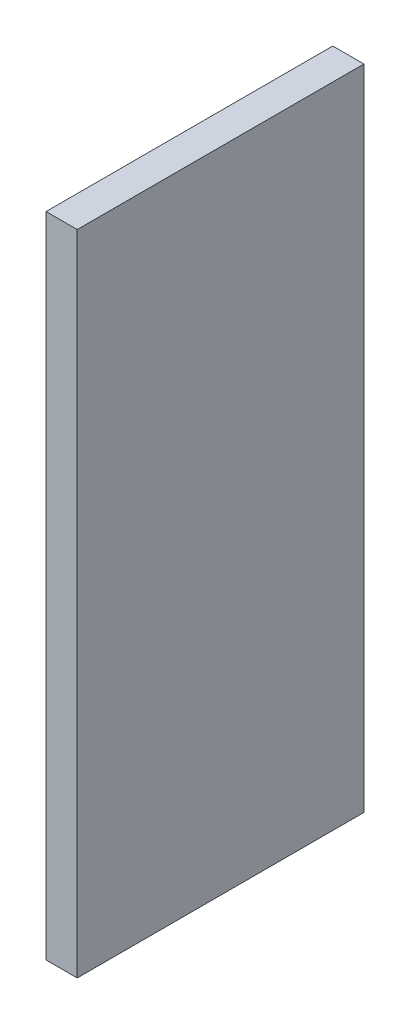
from build123d import *

# Parameters (mm, degrees)
SKETCH_1_W      = 2.5
SKETCH_1_H      = 52
EXTRUDE_1_DEPTH = 23


with BuildPart() as part:
    # 草圖1 → 填料-伸長1 (new body)
    with BuildSketch(Plane.XY):
        Rectangle(SKETCH_1_W, SKETCH_1_H)
    extrude(amount=EXTRUDE_1_DEPTH)


solid = part.part
